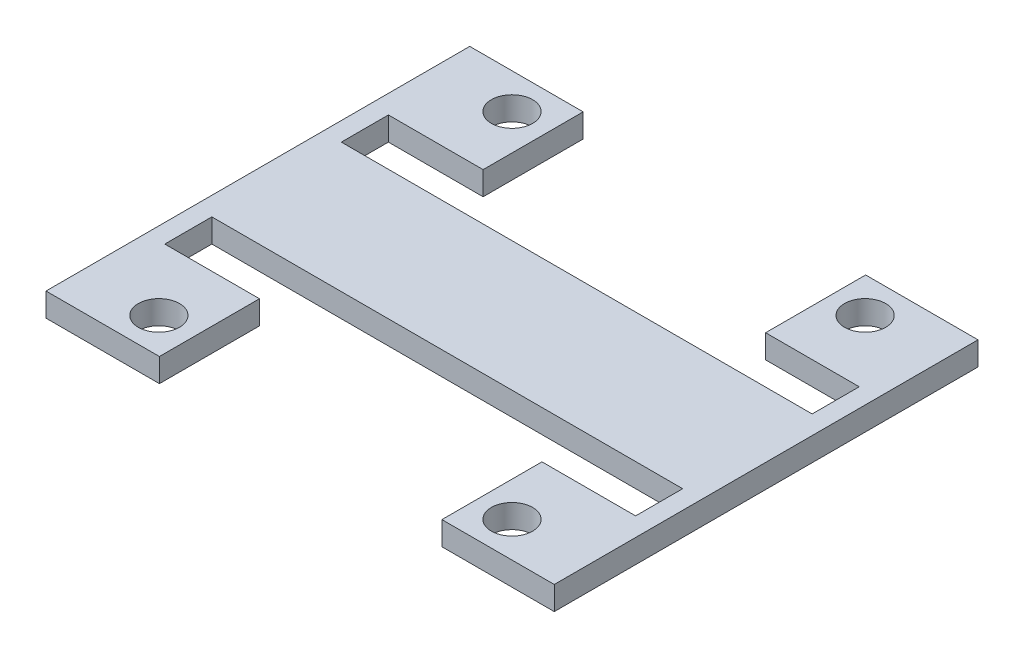
from build123d import *

# Parameters (mm, degrees)
SKETCH1_R           = 1.75
BOSS_EXTRUDE3_DEPTH = 3
SKETCH4_W           = 38.009499712
SKETCH4_H           = 2.5
CUT_EXTRUDE7_DEPTH  = 29.268853886
SKETCH7_W           = 36
SKETCH7_H           = 1
CUT_EXTRUDE8_DEPTH  = 47.877632193
SKETCH9_W           = 39.982004405
SKETCH9_H           = 3.901650926
SKETCH9_W_2         = 38.509499712
SKETCH9_H_2         = 2.8
SKETCH9_W_3         = 37.982004405
SKETCH9_H_3         = 0.55
CUT_EXTRUDE9_DEPTH  = 10
SKETCH10_W          = 40
SKETCH10_H          = 4
SKETCH10_W_2        = 39.982004405
SKETCH10_H_2        = 3.901650926
CUT_EXTRUDE11_DEPTH = 29.180278565
SKETCH11_W          = 20
SKETCH11_H          = 3.116121774
CUT_EXTRUDE12_DEPTH = 10
SKETCH12_W          = 2
SKETCH12_H          = 8.5
CUT_EXTRUDE15_DEPTH = 10


with BuildPart() as part:
    # Sketch1 → Boss-Extrude3 (new body)
    # profile 1 of 2: a face of its own
    with BuildSketch(Plane(origin=(0, 0, 0), x_dir=(1, 0, 0), z_dir=(0, 1, 0))):
        Polygon((-21.59, 18), (-21.59, 0), (0, 0), (21.59, 0), (21.59, 18), (18.04585781, 18), (10.04585781, 18), (10.04585781, 12.616121774), (-9.95414219, 12.616121774), (-9.95414219, 18), (-17.95414219, 18), align=None)
        with Locations(Location((-15, 15, 0), (0, 0, 270))):
            Circle(SKETCH1_R, mode=Mode.SUBTRACT)
        Polygon((18.504745017, 6.25), (0, 6.25), (-18.5, 6.25), (-19.004539265, 6.25), (-19.004539265, 8.75), (-18.5, 8.75), (0.002372509, 8.75), (18.504745017, 8.75), (19.004960447, 8.75), (19.004960447, 6.25), align=None, mode=Mode.SUBTRACT)
        with Locations(Location((15, 15, 0), (0, 0, 270))):
            Circle(SKETCH1_R, mode=Mode.SUBTRACT)
    # profile 2 of 2: a face of its own
    with BuildSketch(Plane(origin=(0, 0, 0), x_dir=(1, 0, 0), z_dir=(0, 1, 0))):
        Polygon((0, 0), (-21.59, 0), (-21.59, -18), (-17.95414219, -18), (-9.95414219, -18), (-9.95414219, -12.616121774), (10.04585781, -12.616121774), (10.04585781, -18), (18.04585781, -18), (21.59, -18), (21.59, 0), align=None)
        with Locations(Location((-15, -15, 0), (0, 0, 270))):
            Circle(SKETCH1_R, mode=Mode.SUBTRACT)
        with Locations(Location((15, -15, 0), (0, 0, 270))):
            Circle(SKETCH1_R, mode=Mode.SUBTRACT)
        Polygon((18.504745017, -6.25), (19.004960447, -6.25), (19.004960447, -8.75), (18.504745017, -8.75), (-18.5, -8.75), (-19.004539265, -8.75), (-19.004539265, -6.25), (-18.5, -6.25), align=None, mode=Mode.SUBTRACT)
    extrude(amount=BOSS_EXTRUDE3_DEPTH)

    # Sketch4 → Cut-Extrude7 (cut, through all)
    # profile 1 of 3: a face of its own
    with BuildSketch(Plane(origin=(0, 3, 0), x_dir=(1, 0, 0), z_dir=(0, 1, 0))):
        Polygon((19.004960447, 6.1), (19.254960447, 6.1), (19.254960447, 8.882786661), (19.254960447, 8.9), (19.004960447, 8.9), (-19.004539265, 8.9), (-19.254539265, 8.9), (-19.254539265, 6.1), (-19.004539265, 6.1), align=None)
        with Locations((0.000210591, 7.5)):
            Rectangle(SKETCH4_W, SKETCH4_H, mode=Mode.SUBTRACT)
    # profile 2 of 3: a face of its own
    with BuildSketch(Plane(origin=(0, 3, 0), x_dir=(1, 0, 0), z_dir=(0, 1, 0))):
        with Locations((0.000210591, 7.5)):
            Rectangle(SKETCH4_W, SKETCH4_H)
    # profile 3 of 3: a face of its own
    with BuildSketch(Plane(origin=(0, 3, 0), x_dir=(1, 0, 0), z_dir=(0, 1, 0))):
        Polygon((-19.254539265, -6.1), (-19.254539265, -8.9), (-19.004539265, -8.9), (19.004960447, -8.9), (19.254960447, -8.9), (19.254960447, -6.1), (19.004960447, -6.1), (-19.004539265, -6.1), align=None)
        with Locations((0.000210591, -7.5)):
            Rectangle(SKETCH4_W, SKETCH4_H, mode=Mode.SUBTRACT)
    extrude(amount=-CUT_EXTRUDE7_DEPTH, mode=Mode.SUBTRACT)

    # Sketch7 → Cut-Extrude8 (cut, through all)
    with BuildSketch(Plane(origin=(21.59, 0, 0), x_dir=(0, 0, -1), z_dir=(1, 0, 0))):
        with Locations((0, 0.5)):
            Rectangle(SKETCH7_W, SKETCH7_H)
    extrude(amount=-CUT_EXTRUDE8_DEPTH, mode=Mode.SUBTRACT)

    # Sketch9 → Cut-Extrude9 (cut)
    # profile 1 of 4: a face of its own
    with BuildSketch(Plane(origin=(0, 3, 0), x_dir=(1, 0, 0), z_dir=(0, 1, 0))):
        with Locations((0.000210592, 7.5)):
            Rectangle(SKETCH9_W, SKETCH9_H)
        with Locations((0.000210591, 7.5)):
            Rectangle(SKETCH9_W_2, SKETCH9_H_2, mode=Mode.SUBTRACT)
    # profile 2 of 4: a face of its own
    with BuildSketch(Plane(origin=(0, 3, 0), x_dir=(1, 0, 0), z_dir=(0, 1, 0))):
        with Locations((0.000210592, -7.5)):
            Rectangle(SKETCH9_W, SKETCH9_H)
        Polygon((-19.254539265, -8.9), (-19.254539265, -6.1), (-18.990791611, -6.1), (-18.990791611, -5.55), (18.991212794, -5.55), (18.991212794, -6.1), (19.254960447, -6.1), (19.254960447, -8.9), (18.991212794, -8.9), (18.991212794, -9.45), (-18.990791611, -9.45), (-18.990791611, -8.9), align=None, mode=Mode.SUBTRACT)
    # profile 3 of 4: a face of its own
    with BuildSketch(Plane(origin=(0, 3, 0), x_dir=(1, 0, 0), z_dir=(0, 1, 0))):
        with Locations((0.000210592, -5.825)):
            Rectangle(SKETCH9_W_3, SKETCH9_H_3)
    # profile 4 of 4: a face of its own
    with BuildSketch(Plane(origin=(0, 3, 0), x_dir=(1, 0, 0), z_dir=(0, 1, 0))):
        with Locations((0.000210592, -9.175)):
            Rectangle(SKETCH9_W_3, SKETCH9_H_3)
    extrude(amount=-CUT_EXTRUDE9_DEPTH, mode=Mode.SUBTRACT)

    # Sketch10 → Cut-Extrude11 (cut, through all)
    # profile 1 of 3: a face of its own
    with BuildSketch(Plane(origin=(0, 3, 0), x_dir=(1, 0, 0), z_dir=(0, 1, 0))):
        with Locations((0.000210591, -7.5)):
            Rectangle(SKETCH10_W, SKETCH10_H)
        with Locations((0.000210592, -7.5)):
            Rectangle(SKETCH10_W_2, SKETCH10_H_2, mode=Mode.SUBTRACT)
    # profile 2 of 3: a face of its own
    with BuildSketch(Plane(origin=(0, 3, 0), x_dir=(1, 0, 0), z_dir=(0, 1, 0))):
        with Locations((0.000210591, 7.5)):
            Rectangle(SKETCH10_W, SKETCH10_H)
        with Locations((0.000210592, 7.5)):
            Rectangle(SKETCH10_W_2, SKETCH10_H_2, mode=Mode.SUBTRACT)
    # profile 3 of 3: a face of its own
    with BuildSketch(Plane(origin=(0, 3, 0), x_dir=(1, 0, 0), z_dir=(0, 1, 0))):
        with Locations((0.000210592, 7.5)):
            Rectangle(SKETCH10_W_2, SKETCH10_H_2)
    extrude(amount=-CUT_EXTRUDE11_DEPTH, mode=Mode.SUBTRACT)

    # Sketch11 → Cut-Extrude12 (cut)
    with BuildSketch(Plane(origin=(0, 3, 0), x_dir=(1, 0, 0), z_dir=(0, 1, 0))):
        with Locations((0.04585781, -11.058060887)):
            Rectangle(SKETCH11_W, SKETCH11_H)
        with Locations((0.04585781, 11.058060887)):
            Rectangle(SKETCH11_W, SKETCH11_H)
    extrude(amount=-CUT_EXTRUDE12_DEPTH, mode=Mode.SUBTRACT)

    # Sketch12 → Cut-Extrude15 (cut)
    with BuildSketch(Plane(origin=(0, 3, 0), x_dir=(1, 0, 0), z_dir=(0, 1, 0))):
        with Locations((-10.95414219, -13.75)):
            Rectangle(SKETCH12_W, SKETCH12_H)
        with Locations((-10.95414219, 13.75)):
            Rectangle(SKETCH12_W, SKETCH12_H)
        with Locations((11.04585781, 13.75)):
            Rectangle(SKETCH12_W, SKETCH12_H)
        Polygon((10.04585781, -9.65592739), (10.04585781, -18), (12.04585781, -18), (12.04585781, -9.65592739), (12.04585781, -9.5), (10.04585781, -9.5), align=None)
    extrude(amount=-CUT_EXTRUDE15_DEPTH, mode=Mode.SUBTRACT)


solid = part.part
